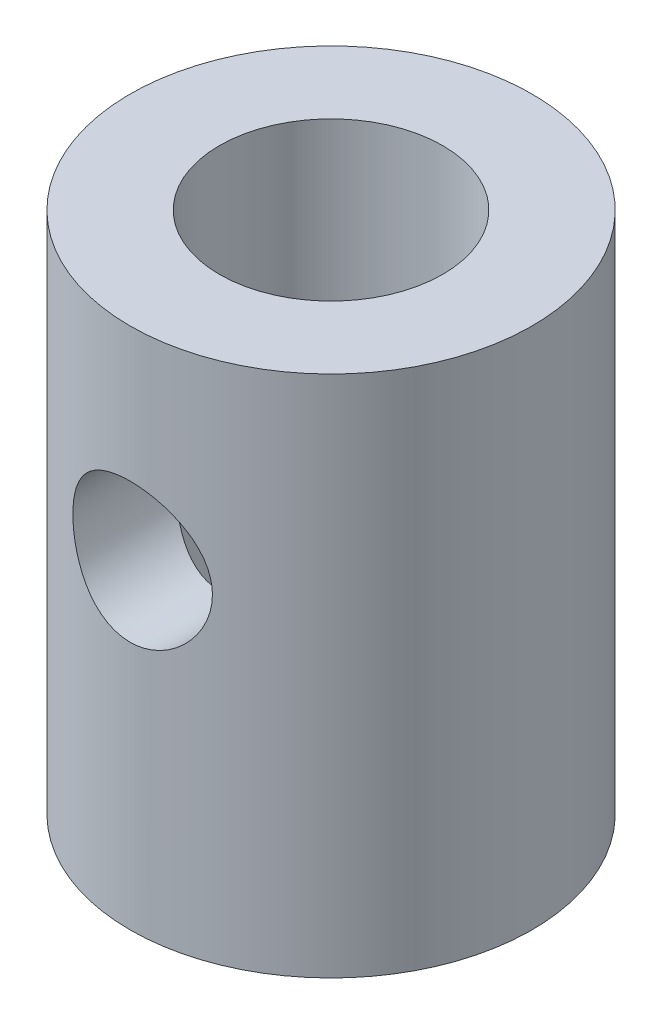
from build123d import *

# Parameters (mm, degrees)
SKETCH1_R           = 8.001
SKETCH1_R_2         = 4.445
BOSS_EXTRUDE1_DEPTH = 20.828
SKETCH2_R           = 2.77876
CUT_EXTRUDE1_DEPTH  = 6.35


with BuildPart() as part:
    # Sketch1 → Boss-Extrude1 (new body)
    with BuildSketch(Plane(origin=(0, 0, 0), x_dir=(1, 0, 0), z_dir=(0, 1, 0))):
        with Locations(Location((0, 0, 0), (0, 0, 270))):
            Circle(SKETCH1_R)
        with Locations(Location((0, 0, 0), (0, 0, 270))):
            Circle(SKETCH1_R_2, mode=Mode.SUBTRACT)
    extrude(amount=BOSS_EXTRUDE1_DEPTH)

    # Sketch2 → Cut-Extrude1 (cut)
    with BuildSketch(Plane.XY.offset(8.001)):
        with Locations((0, 12.7)):
            Circle(SKETCH2_R)
    extrude(amount=-CUT_EXTRUDE1_DEPTH, mode=Mode.SUBTRACT)


solid = part.part
